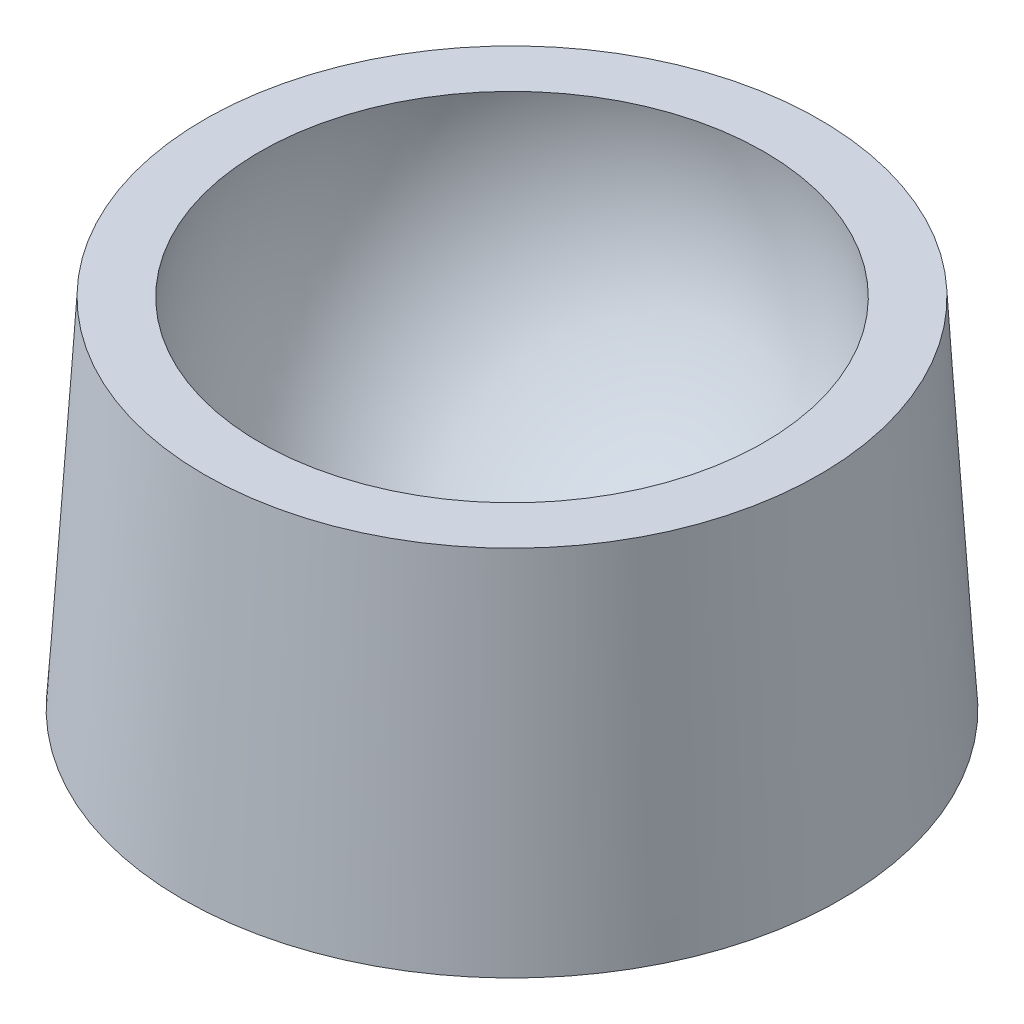
from build123d import *

# Parameters (mm, degrees)
IZIM2_R               = 1.25
KES_EKSTR_ZYON1_DEPTH = 10


with BuildPart() as part:
    # Çizim1 → Döndür3 (revolve)
    with BuildSketch(Plane(origin=(0, 0, 0), x_dir=(0, 0, -1), z_dir=(1, 0, 0)), mode=Mode.PRIVATE) as d_nd_r3_sk:
        with BuildLine():
            Line((0, 1.4985), (0, 0))
            Line((0, 0), (1.24875, 0))
            Line((1.24875, 0), (4.868655858, 0))
            ThreePointArc((4.868655858, 0), (5.951824945, 0.454850463), (6.993, 0.999))
            Line((6.993, 0.999), (11.838744981, 0.999))
            Line((11.838744981, 0.999), (12.913678251, 0.999))
            Line((12.913678251, 0.999), (12.896228404, 1.284302481))
            Line((12.896228404, 1.284302481), (12.058257846, 14.985))
            Line((12.058257846, 14.985), (9.876973107, 14.985))
            ThreePointArc((9.876973107, 14.985), (8.649440213, 8.487771762), (3.632727273, 4.180405623))
            ThreePointArc((3.632727273, 4.180405623), (3.171102899, 3.813308184), (2.997, 3.249796185))
            Line((2.997, 3.249796185), (2.997, 1.4985))
            Line((2.997, 1.4985), (1.24875, 1.4985))
            Line((1.24875, 1.4985), (0, 1.4985))
        make_face()
    revolve(d_nd_r3_sk.sketch.rotate(Axis((0, 1.4985, 0), (0, -1, 0)), 180), axis=Axis((0, 1.4985, 0), (0, -1, 0)))

    # Çizim2 → Kes-Ekstrüzyon1 (cut)
    with BuildSketch(Plane.XZ):
        with Locations(Location((0, 0, 0), (0, 0, 270))):
            Circle(IZIM2_R)
    extrude(amount=-KES_EKSTR_ZYON1_DEPTH, mode=Mode.SUBTRACT)


solid = part.part
